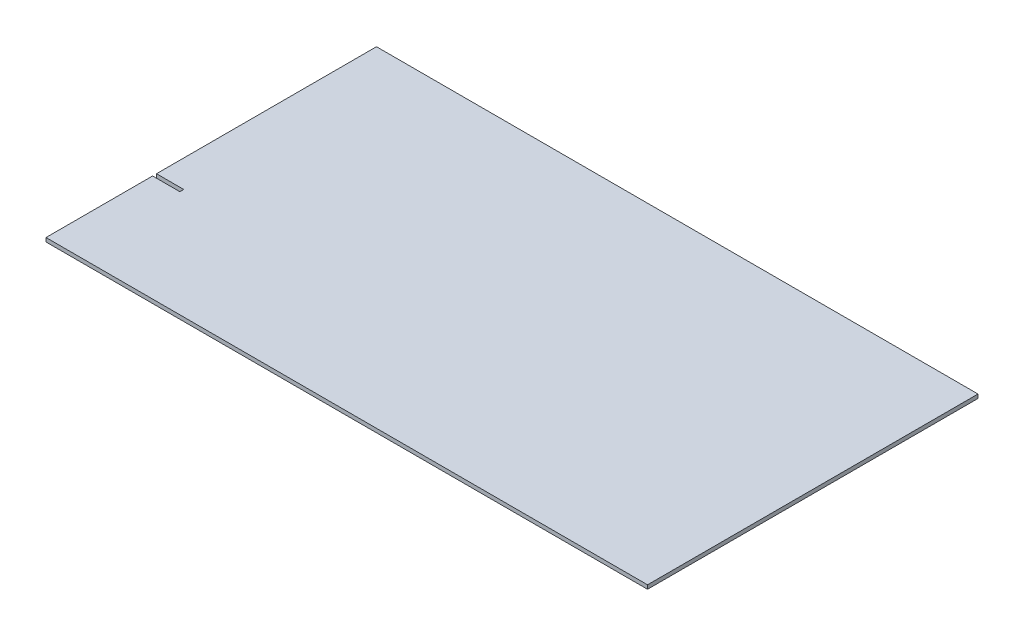
from build123d import *

# Parameters (mm, degrees)
SKETCH1_W           = 309
SKETCH1_H           = 169.76
BOSS_EXTRUDE1_DEPTH = 2
SKETCH2_W           = 14
SKETCH2_H           = 2
CUT_EXTRUDE1_DEPTH  = 10


with BuildPart() as part:
    # Sketch1 → Boss-Extrude1 (new body)
    with BuildSketch(Plane(origin=(0, 0, 0), x_dir=(1, 0, 0), z_dir=(0, 1, 0))):
        with Locations((154.5, 84.88)):
            Rectangle(SKETCH1_W, SKETCH1_H)
    extrude(amount=BOSS_EXTRUDE1_DEPTH)

    # Sketch2 → Cut-Extrude1 (cut)
    with BuildSketch(Plane(origin=(0, 2, 0), x_dir=(1, 0, 0), z_dir=(0, 1, 0))):
        with Locations((7, 55.76)):
            Rectangle(SKETCH2_W, SKETCH2_H)
    extrude(amount=-CUT_EXTRUDE1_DEPTH, mode=Mode.SUBTRACT)


solid = part.part
